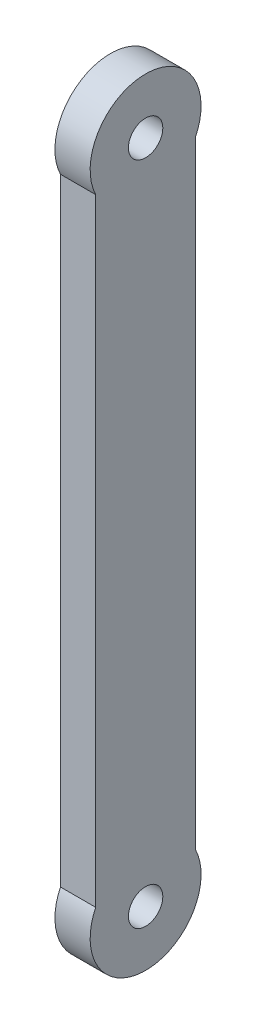
from build123d import *

# Parameters (mm, degrees)
SKETCH1_R           = 1.55
BOSS_EXTRUDE3_DEPTH = 3.175


with BuildPart() as part:
    # Sketch1 → Boss-Extrude3 (new body)
    with BuildSketch(Plane(origin=(0, 0, 0), x_dir=(0, 0, -1), z_dir=(1, 0, 0))):
        with BuildLine():
            Line((4.5, -2.179449472), (4.5, -57.820550528))
            ThreePointArc((4.5, -57.820550528), (0, -65), (-4.5, -57.820550528))
            Line((-4.5, -57.820550528), (-4.5, -2.179449472))
            ThreePointArc((-4.5, -2.179449472), (0, 5), (4.5, -2.179449472))
        make_face()
        Circle(SKETCH1_R, mode=Mode.SUBTRACT)
        with Locations((0, -60)):
            Circle(SKETCH1_R, mode=Mode.SUBTRACT)
    extrude(amount=BOSS_EXTRUDE3_DEPTH)


solid = part.part
